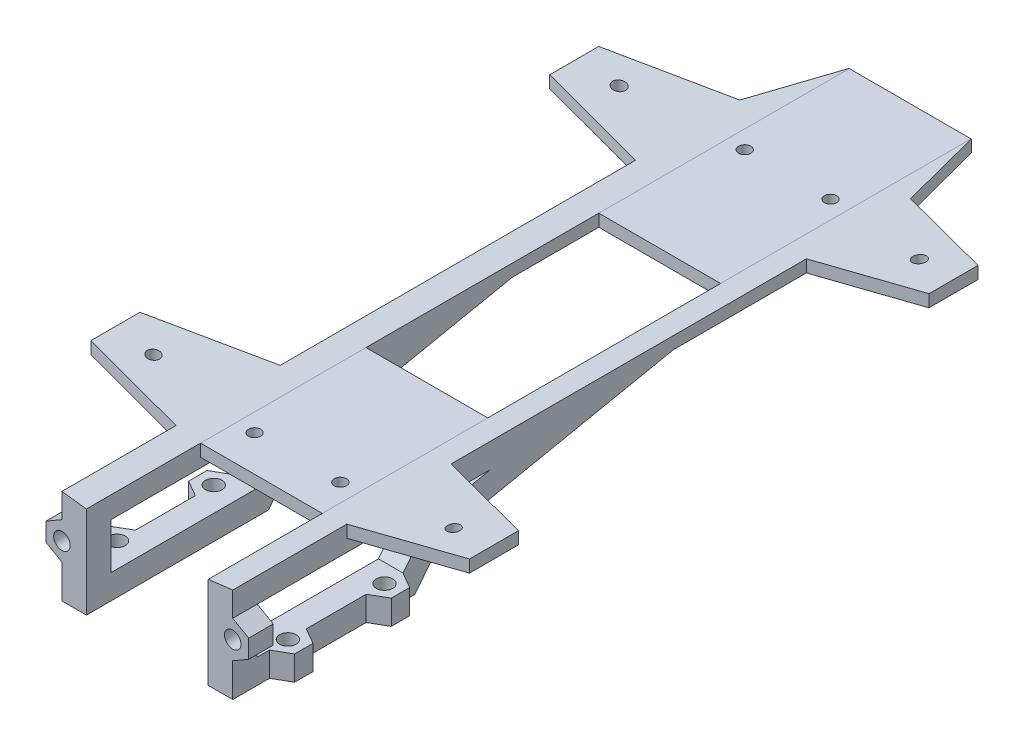
from build123d import *

# Parameters (mm, degrees)
SKETCH_1_W          = 2
SKETCH_1_H          = 2
EXTRUDE_1_DEPTH     = 3
EXTRUDE_2_DEPTH     = 124.5
SKETCH_3_W          = 6.103798984
SKETCH_3_H          = 7.216344691
CUT_EXTRUDE_1_DEPTH = 100
SKETCH_4_R          = 1
SKETCH_4_R_2        = 1.050016024
SKETCH_4_R_3        = 1.05
CUT_EXTRUDE_2_DEPTH = 100
SKETCH_6_W          = 76.933972046
SKETCH_6_H          = 147.245046369
CUT_EXTRUDE_3_DEPTH = 100
EXTRUDE_3_DEPTH     = 2
EXTRUDE_4_DEPTH     = 4
SKETCH_9_W          = 19.878498858
SKETCH_9_H          = 18.624082489
CUT_EXTRUDE_4_DEPTH = 4
SKETCH_10_W         = 19.878498858
SKETCH_10_H         = 38
CUT_EXTRUDE_5_DEPTH = 4
EXTRUDE_6_DEPTH     = 4
EXTRUDE_7_DEPTH     = 4
SKETCH_14_R         = 1.35
CUT_EXTRUDE_7_DEPTH = 4
SKETCH_15_R         = 1.35
CUT_EXTRUDE_8_DEPTH = 4


with BuildPart() as part:
    # 草图1 → 凸台-拉伸1 (new body)
    with BuildSketch(Plane(origin=(0, 0, 0), x_dir=(1, 0, 0), z_dir=(0, 1, 0))):
        Rectangle(SKETCH_1_W, SKETCH_1_H)
    extrude(amount=EXTRUDE_1_DEPTH)

    # 草图2 → 凸台-拉伸2 (add)
    with BuildSketch(Plane(origin=(0, 0, -1), x_dir=(-1, 0, 0), z_dir=(0, 0, -1))):
        Polygon((-9.439249429, 3), (10.439249429, 3), (31.447953726, 5.562037109), (31.447953726, 3.562037109), (10.439249429, 1), (-9.439249429, 1), (-30.447953726, 3.562037109), (-30.447953726, 5.562037109), align=None)
    extrude(amount=-EXTRUDE_2_DEPTH)

    # 草图3 → 切除-拉伸1 (cut)
    with BuildSketch(Plane.XZ.offset(-1)):
        with Locations((-0.416327581, 1.421882079)):
            Rectangle(SKETCH_3_W, SKETCH_3_H)
    extrude(amount=CUT_EXTRUDE_1_DEPTH, mode=Mode.SUBTRACT)

    # 草图4 → 切除-拉伸2 (cut)
    with BuildSketch(Plane.XZ.offset(-1)):
        with Locations(Location((24, 97.999988001, 0), (0, 0, 180))):
            Circle(SKETCH_4_R)
        with Locations(Location((6.500166, 99, 0), (0, 0, 270))):
            Circle(SKETCH_4_R)
        with Locations(Location((-7.499834, 99, 0), (0, 0, 270))):
            Circle(SKETCH_4_R)
        with Locations((-24.999894002, 97.999988001)):
            Circle(SKETCH_4_R)
        with Locations(Location((6.500166, 19, 0), (0, 0, 270))):
            Circle(SKETCH_4_R)
        with Locations(Location((-7.499834, 19, 0), (0, 0, 270))):
            Circle(SKETCH_4_R)
        with Locations(Location((24, 21.999986001, 0), (0, 0, 180))):
            Circle(SKETCH_4_R_2)
        with Locations((-24.999894002, 21.999986001)):
            Circle(SKETCH_4_R_3)
    extrude(amount=-CUT_EXTRUDE_2_DEPTH, mode=Mode.SUBTRACT)

    # 草图6 → 切除-拉伸3 (cut)
    with BuildSketch(Plane.XZ.offset(-1)):
        with Locations((-0.585190424, 56.41539679)):
            Rectangle(SKETCH_6_W, SKETCH_6_H)
        Polygon((-31.447953726, 18.875917511), (-14.439249429, 12.875917511), (-10.439249429, -1.124082489), (9.439249429, -1.124082489), (13.439249429, 12.875917511), (30.447953726, 18.875917511), (30.447953726, 26.875917511), (13.439249429, 29.875917511), (13.439249429, 87.875917511), (30.447953726, 93.875917511), (30.447953726, 101.875917511), (13.439249429, 104.875917511), (13.439249429, 123.5), (-14.439249429, 123.5), (-14.439249429, 104.875917511), (-31.329711994, 101.875917511), (-31.329711994, 93.875917511), (-14.439249429, 87.875917511), (-14.439249429, 29.875917511), (-31.447953726, 26.875917511), align=None, mode=Mode.SUBTRACT)
    extrude(amount=-CUT_EXTRUDE_3_DEPTH, mode=Mode.SUBTRACT)

    # 草图7 → 凸台-拉伸3 (add)
    with BuildSketch(Plane.XY.offset(123.5)):
        Polygon((-14.439249429, 1.487804878), (-10.439249429, 1), (-10.439249429, -12), (-14.439249429, -12), (-14.439249429, 1), align=None)
    extrude_3 = extrude(amount=-EXTRUDE_3_DEPTH)

    # 草图8 → 凸台-拉伸4 (add)
    with BuildSketch(Plane.ZY.offset(14.439249429)):
        Polygon((51.587761239, 1.487804878), (121.5, 1.487804878), (121.5, -12), (93.804336039, -12), (89.124737206, -6.169338891), align=None)
        Polygon((81.404880427, -0.512195122), (119.5, -0.512195122), (119.5, -8), (106.737581435, -8), (95.722961725, -8), (92.704938742, -4.239620134), (91.339916161, -2.53883672), align=None, mode=Mode.SUBTRACT)
    extrude_4 = extrude(amount=-EXTRUDE_4_DEPTH)

    # 草图9 → 切除-拉伸4 (cut)
    with BuildSketch(Plane(origin=(0, 3, 0), x_dir=(1, 0, 0), z_dir=(0, 1, 0))):
        with Locations((-0.5, -114.187958756)):
            Rectangle(SKETCH_9_W, SKETCH_9_H)
    cut_extrude_4 = extrude(amount=-CUT_EXTRUDE_4_DEPTH, mode=Mode.SUBTRACT)

    # 草图10 → 切除-拉伸5 (cut)
    with BuildSketch(Plane(origin=(0, 3, 0), x_dir=(1, 0, 0), z_dir=(0, 1, 0))):
        with Locations((-0.5, -58.875917511)):
            Rectangle(SKETCH_10_W, SKETCH_10_H)
    cut_extrude_5 = extrude(amount=-CUT_EXTRUDE_5_DEPTH, mode=Mode.SUBTRACT)

    # 草图11 → 凸台-拉伸6 (add)
    with BuildSketch(Plane.XZ.offset(12)):
        Polygon((-17.03732564, 97.222961725), (-14.439249429, 95.722961725), (-14.439249429, 101.722961725), (-17.03732564, 100.222961725), align=None)
        Polygon((-17.03732564, 113), (-14.439249429, 111.5), (-14.439249429, 117.5), (-17.03732564, 116), align=None)
    extrude_6 = extrude(amount=-EXTRUDE_6_DEPTH)

    # 草图13 → 凸台-拉伸7 (add)
    with BuildSketch(Plane.XY.offset(123.5)):
        Polygon((-14.439249429, -6.512195122), (-14.439249429, -0.512195122), (-17.03732564, -2.012195122), (-17.03732564, -5.012195122), align=None)
    extrude_7 = extrude(amount=-EXTRUDE_7_DEPTH)

    # 草图14 → 切除-拉伸7 (cut)
    with BuildSketch(Plane.XY.offset(123.5)):
        with Locations((-14.439249429, -3.512195122)):
            Circle(SKETCH_14_R)
    cut_extrude_7 = extrude(amount=-CUT_EXTRUDE_7_DEPTH, mode=Mode.SUBTRACT)

    # 草图15 → 切除-拉伸8 (cut)
    with BuildSketch(Plane.XZ.offset(12)):
        with Locations(Location((-14.439249429, 98.722961725, 0), (0, 0, 270))):
            Circle(SKETCH_15_R)
        with Locations(Location((-14.439249429, 114.5, 0), (0, 0, 270))):
            Circle(SKETCH_15_R)
    cut_extrude_8 = extrude(amount=-CUT_EXTRUDE_8_DEPTH, mode=Mode.SUBTRACT)

    # 镜向1: 凸台-拉伸3, 凸台-拉伸4, 切除-拉伸4, 切除-拉伸5, 凸台-拉伸6, 凸台-拉伸7, 切除-拉伸7, 切除-拉伸8 across plane
    add(extrude_3.mirror(Plane.ZY.offset(0.5)))
    add(extrude_4.mirror(Plane.ZY.offset(0.5)))
    add(cut_extrude_4.mirror(Plane.ZY.offset(0.5)), mode=Mode.SUBTRACT)
    add(cut_extrude_5.mirror(Plane.ZY.offset(0.5)), mode=Mode.SUBTRACT)
    add(extrude_6.mirror(Plane.ZY.offset(0.5)))
    add(extrude_7.mirror(Plane.ZY.offset(0.5)))
    add(cut_extrude_7.mirror(Plane.ZY.offset(0.5)), mode=Mode.SUBTRACT)
    add(cut_extrude_8.mirror(Plane.ZY.offset(0.5)), mode=Mode.SUBTRACT)


solid = part.part
